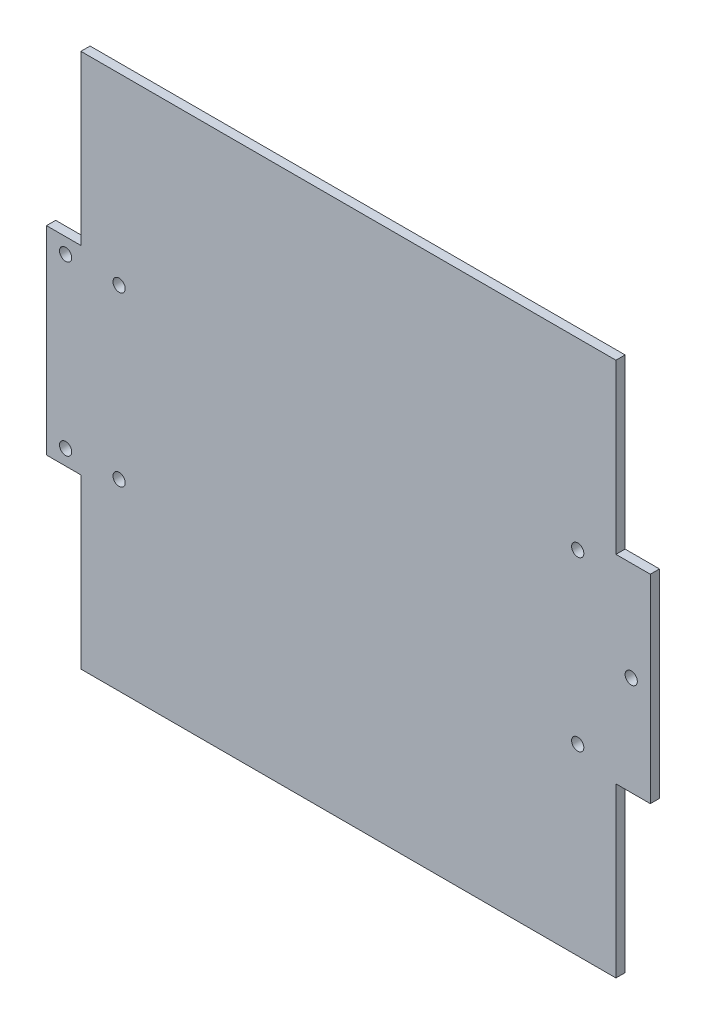
from build123d import *

# Parameters (mm, degrees)
BOSS_EXTRUDE1_DEPTH            = 2.4
F_3_2_3_2_DIAMETER_HOLE1_D     = 3.2
F_3_2_3_2_DIAMETER_HOLE1_DEPTH = 4
F_3_2_3_2_DIAMETER_HOLE1_TIP   = 0.96137699
SKETCH8_R                      = 1.6
CUT_EXTRUDE2_DEPTH             = 205.467014455


with BuildPart() as part:
    # Sketch1 → Boss-Extrude1 (new body)
    with BuildSketch(Plane.XY):
        Polygon((0, 0), (140, 0), (140, 44), (149, 44), (149, 96), (140, 96), (140, 140), (0, 140), (0, 96), (-9, 96), (-9, 44), (0, 44), align=None)
    extrude(amount=BOSS_EXTRUDE1_DEPTH)

    # Ø3.2 (3.2) Diameter Hole1
    with Locations(Plane(origin=(0, 0, 0), x_dir=(-1, 0, 0), z_dir=(0, 0, -1))):
        with Locations((-130, 92), (-130, 48), (-10, 92), (-10, 48)):
            Hole(F_3_2_3_2_DIAMETER_HOLE1_D / 2, depth=F_3_2_3_2_DIAMETER_HOLE1_DEPTH)
            with Locations((0, 0, -(F_3_2_3_2_DIAMETER_HOLE1_DEPTH + F_3_2_3_2_DIAMETER_HOLE1_TIP / 2))):  # 118° drill point
                Cone(0, F_3_2_3_2_DIAMETER_HOLE1_D / 2, F_3_2_3_2_DIAMETER_HOLE1_TIP, mode=Mode.SUBTRACT)

    # Sketch8 → Cut-Extrude2 (cut, through all)
    with BuildSketch(Plane.XY.offset(2.4)):
        with Locations((-4, 92)):
            Circle(SKETCH8_R)
        with Locations((-4, 48)):
            Circle(SKETCH8_R)
        with Locations((144, 70)):
            Circle(SKETCH8_R)
    extrude(amount=-CUT_EXTRUDE2_DEPTH, mode=Mode.SUBTRACT)


solid = part.part
